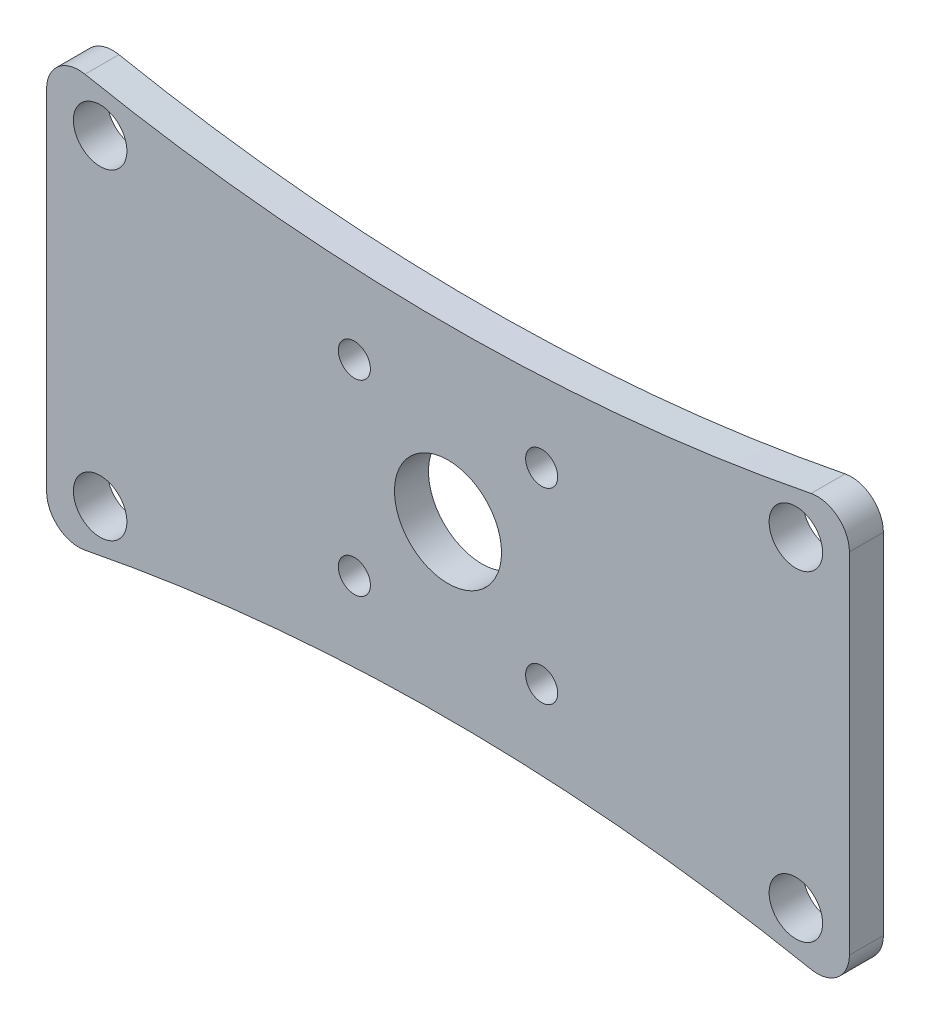
from build123d import *

# Parameters (mm, degrees)
SKETCH1_W           = 75
SKETCH1_H           = 40
SKETCH1_R           = 2.5
SKETCH1_R_2         = 1.5
BOSS_EXTRUDE1_DEPTH = 3.175
SKETCH2_R           = 175
CUT_EXTRUDE1_DEPTH  = 3.175
FILLET1_R           = 3
SKETCH3_R           = 5
CUT_EXTRUDE2_DEPTH  = 3.175


with BuildPart() as part:
    # Sketch1 → Boss-Extrude1 (new body)
    with BuildSketch(Plane.XY):
        Rectangle(SKETCH1_W, SKETCH1_H)
        with Locations((-32.5, 15)):
            Circle(SKETCH1_R, mode=Mode.SUBTRACT)
        with Locations((32.5, 15)):
            Circle(SKETCH1_R, mode=Mode.SUBTRACT)
        with Locations((32.5, -15)):
            Circle(SKETCH1_R, mode=Mode.SUBTRACT)
        with Locations((-32.5, -15)):
            Circle(SKETCH1_R, mode=Mode.SUBTRACT)
        with Locations((-8.75, 8.75)):
            Circle(SKETCH1_R_2, mode=Mode.SUBTRACT)
        with Locations((8.75, 8.75)):
            Circle(SKETCH1_R_2, mode=Mode.SUBTRACT)
        with Locations((8.75, -8.75)):
            Circle(SKETCH1_R_2, mode=Mode.SUBTRACT)
        with Locations((-8.75, -8.75)):
            Circle(SKETCH1_R_2, mode=Mode.SUBTRACT)
    extrude(amount=BOSS_EXTRUDE1_DEPTH)

    # Sketch2 → Cut-Extrude1 (cut)
    with BuildSketch(Plane.XY.offset(3.175)):
        with Locations((0, 190.93492914)):
            Circle(SKETCH2_R)
        with Locations((0, -190.93492914)):
            Circle(SKETCH2_R)
    extrude(amount=-CUT_EXTRUDE1_DEPTH, mode=Mode.SUBTRACT)

    # Fillet1
    fillet1_edges = [part.edges().sort_by_distance(p)[0] for p in [
        (-37.5, 20, 1.5875),
        (37.5, 20, 1.5875),
        (37.5, -20, 1.5875),
        (-37.5, -20, 1.5875),
    ]]
    fillet(fillet1_edges, radius=FILLET1_R)

    # Sketch3 → Cut-Extrude2 (cut)
    with BuildSketch(Plane.XY.offset(3.175)):
        Circle(SKETCH3_R)
    extrude(amount=-CUT_EXTRUDE2_DEPTH, mode=Mode.SUBTRACT)


solid = part.part
